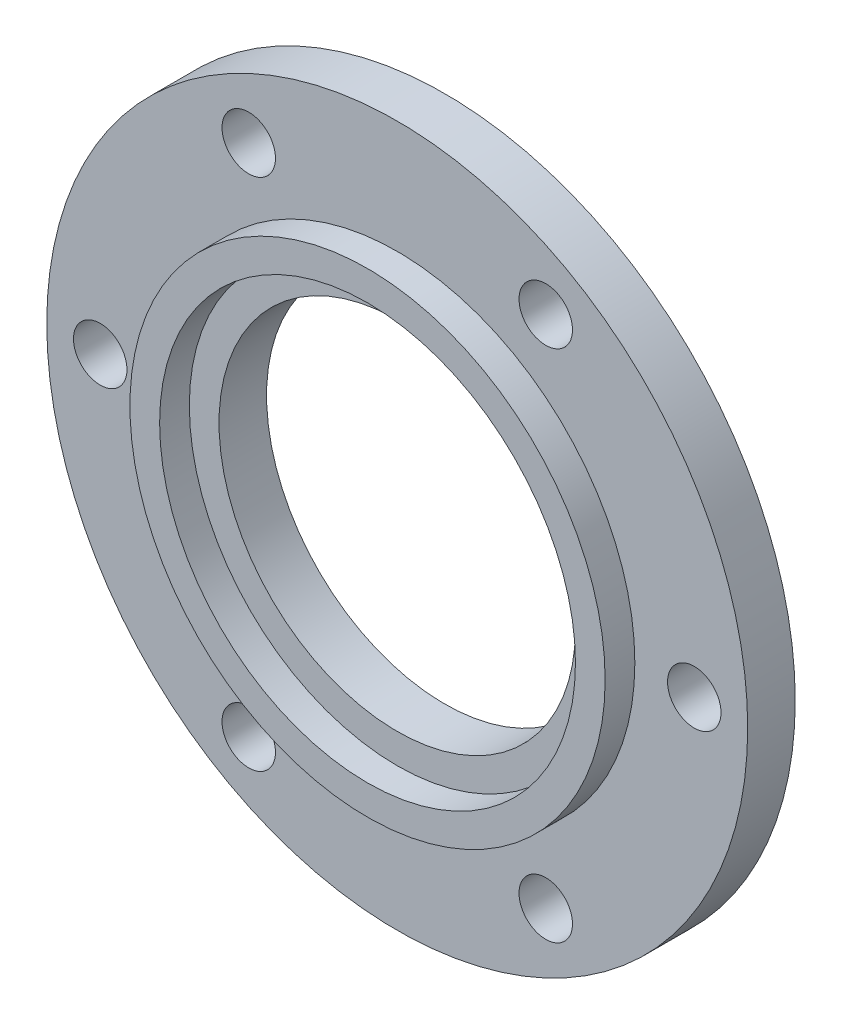
from build123d import *

# Parameters (mm, degrees)
SKETCH_1_R                      = 59
SKETCH_1_R_2                    = 30
EXTRUDE_1_DEPTH                 = 8
SKETCH_2_R                      = 40
SKETCH_2_R_2                    = 35
EXTRUDE_2_DEPTH                 = 5
CUT_EXTRUDE_1_REACH             = 85.821
SKETCH_3_R                      = 4.5
CUT_EXTRUDE_1_DIRECTION_2_DEPTH = 84.821238359


with BuildPart() as part:
    # 草图1 → 凸台-拉伸1 (new body)
    with BuildSketch(Plane.XY):
        Circle(SKETCH_1_R)
        Circle(SKETCH_1_R_2, mode=Mode.SUBTRACT)
    extrude(amount=EXTRUDE_1_DEPTH)

    # 草图2 → 凸台-拉伸2 (add)
    with BuildSketch(Plane.XY.offset(8)):
        Circle(SKETCH_2_R)
        Circle(SKETCH_2_R_2, mode=Mode.SUBTRACT)
    extrude(amount=EXTRUDE_2_DEPTH)

    # 草图3 → 切除-拉伸1 (cut, up to next)
    with BuildSketch(Plane.XY.offset(8), mode=Mode.PRIVATE) as cut_extrude_1_sk1:
        with Locations((25, 43.301270189)):
            Circle(SKETCH_3_R)
    cut_extrude_1_tool1 = extrude(cut_extrude_1_sk1.sketch, amount=-CUT_EXTRUDE_1_REACH, mode=Mode.PRIVATE) & part.part
    # 草图3 → 切除-拉伸1 (cut, up to next)
    with BuildSketch(Plane.XY.offset(8), mode=Mode.PRIVATE) as cut_extrude_1_sk2:
        with Locations((50, 0)):
            Circle(SKETCH_3_R)
    cut_extrude_1_tool2 = extrude(cut_extrude_1_sk2.sketch, amount=-CUT_EXTRUDE_1_REACH, mode=Mode.PRIVATE) & part.part
    # 草图3 → 切除-拉伸1 (cut, up to next)
    with BuildSketch(Plane.XY.offset(8), mode=Mode.PRIVATE) as cut_extrude_1_sk3:
        with Locations((25, -43.301270189)):
            Circle(SKETCH_3_R)
    cut_extrude_1_tool3 = extrude(cut_extrude_1_sk3.sketch, amount=-CUT_EXTRUDE_1_REACH, mode=Mode.PRIVATE) & part.part
    # 草图3 → 切除-拉伸1 (cut, up to next)
    with BuildSketch(Plane.XY.offset(8), mode=Mode.PRIVATE) as cut_extrude_1_sk4:
        with Locations((-25, -43.301270189)):
            Circle(SKETCH_3_R)
    cut_extrude_1_tool4 = extrude(cut_extrude_1_sk4.sketch, amount=-CUT_EXTRUDE_1_REACH, mode=Mode.PRIVATE) & part.part
    # 草图3 → 切除-拉伸1 (cut, up to next)
    with BuildSketch(Plane.XY.offset(8), mode=Mode.PRIVATE) as cut_extrude_1_sk5:
        with Locations((-50, 0)):
            Circle(SKETCH_3_R)
    cut_extrude_1_tool5 = extrude(cut_extrude_1_sk5.sketch, amount=-CUT_EXTRUDE_1_REACH, mode=Mode.PRIVATE) & part.part
    # 草图3 → 切除-拉伸1 (cut, up to next)
    with BuildSketch(Plane.XY.offset(8), mode=Mode.PRIVATE) as cut_extrude_1_sk6:
        with Locations((-25, 43.301270189)):
            Circle(SKETCH_3_R)
    cut_extrude_1_tool6 = extrude(cut_extrude_1_sk6.sketch, amount=-CUT_EXTRUDE_1_REACH, mode=Mode.PRIVATE) & part.part
    add(cut_extrude_1_tool1.solids().sort_by_distance((25, 43.30127, 8))[0], mode=Mode.SUBTRACT)
    add(cut_extrude_1_tool2.solids().sort_by_distance((50, 0, 8))[0], mode=Mode.SUBTRACT)
    add(cut_extrude_1_tool3.solids().sort_by_distance((25, -43.30127, 8))[0], mode=Mode.SUBTRACT)
    add(cut_extrude_1_tool4.solids().sort_by_distance((-25, -43.30127, 8))[0], mode=Mode.SUBTRACT)
    add(cut_extrude_1_tool5.solids().sort_by_distance((-50, 0, 8))[0], mode=Mode.SUBTRACT)
    add(cut_extrude_1_tool6.solids().sort_by_distance((-25, 43.30127, 8))[0], mode=Mode.SUBTRACT)

    # 草图3 → 切除-拉伸1 direction 2 (cut)
    with BuildSketch(Plane.XY.offset(8)):
        with Locations((25, 43.301270189)):
            Circle(SKETCH_3_R)
        with Locations((50, 0)):
            Circle(SKETCH_3_R)
        with Locations((25, -43.301270189)):
            Circle(SKETCH_3_R)
        with Locations((-25, -43.301270189)):
            Circle(SKETCH_3_R)
        with Locations((-50, 0)):
            Circle(SKETCH_3_R)
        with Locations((-25, 43.301270189)):
            Circle(SKETCH_3_R)
    extrude(amount=CUT_EXTRUDE_1_DIRECTION_2_DEPTH, mode=Mode.SUBTRACT)


solid = part.part
